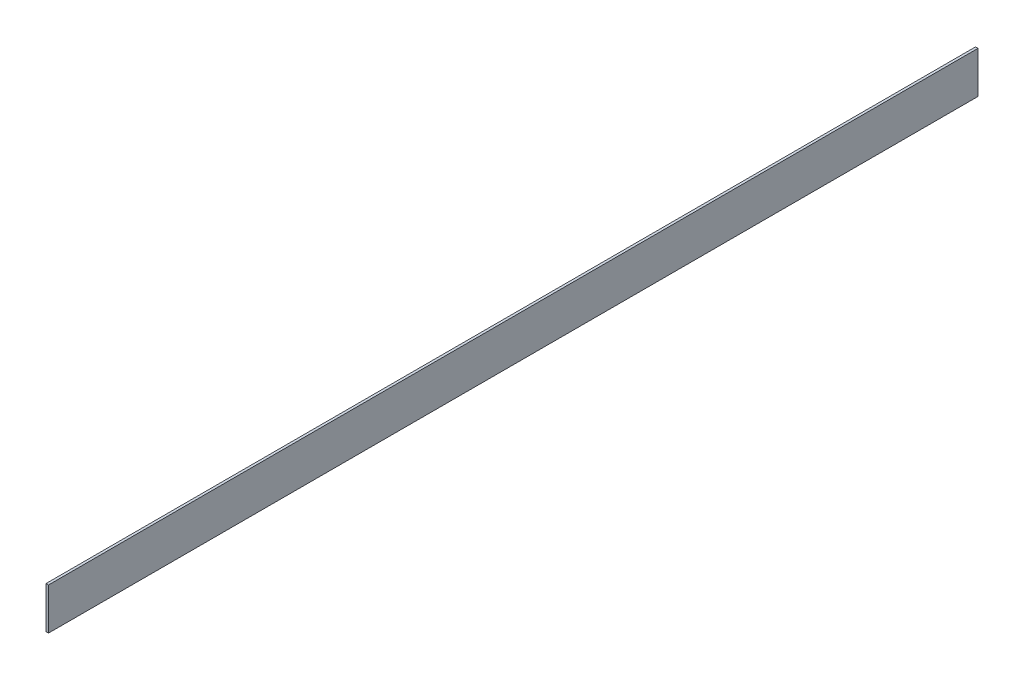
from build123d import *

# Parameters (mm, degrees)
SKETCH1_W           = 3.175
SKETCH1_H           = 53.34
BOSS_EXTRUDE1_DEPTH = 1188.466


with BuildPart() as part:
    # Sketch1 → Boss-Extrude1 (new body)
    with BuildSketch(Plane.XY):
        with Locations((1.5875, 26.67)):
            Rectangle(SKETCH1_W, SKETCH1_H)
    extrude(amount=BOSS_EXTRUDE1_DEPTH)


solid = part.part
